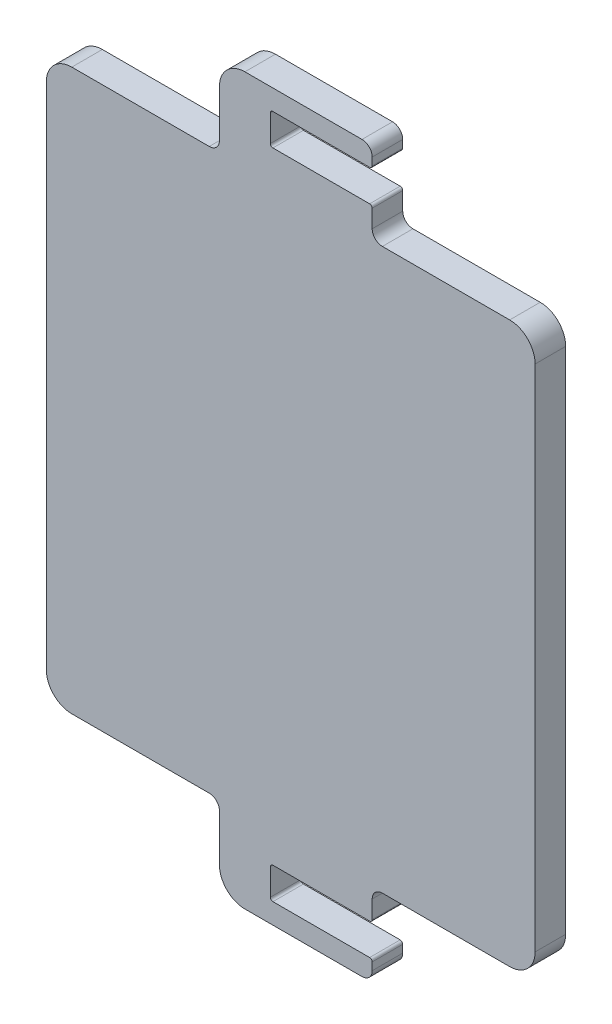
from build123d import *

# Parameters (mm, degrees)
SALIENTE_EXTRUIR1_DEPTH = 3
REDONDEO1_R             = 1
REDONDEO2_R             = 0.25


with BuildPart() as part:
    # Croquis1 → Saliente-Extruir1 (new body)
    with BuildSketch(Plane.XY):
        with BuildLine():
            Line((-24, 25), (-24, -25))
            ThreePointArc((-24, -25), (-23.267766953, -26.767766953), (-21.5, -27.5))
            Line((-21.5, -27.5), (-7, -27.5))
            Line((-7, -27.5), (-7, -33.1))
            ThreePointArc((-7, -33.1), (-6.267766953, -34.867766953), (-4.5, -35.6))
            Line((-4.5, -35.6), (8, -35.6))
            Line((8, -35.6), (8, -33.6))
            Line((8, -33.6), (-2, -33.6))
            Line((-2, -33.6), (-2, -30.5))
            Line((-2, -30.5), (8, -30.5))
            Line((8, -30.5), (8, -27.5))
            Line((8, -27.5), (21.5, -27.5))
            ThreePointArc((21.5, -27.5), (23.267766953, -26.767766953), (24, -25))
            Line((24, -25), (24, 25))
            ThreePointArc((24, 25), (23.267766953, 26.767766953), (21.5, 27.5))
            Line((21.5, 27.5), (8, 27.5))
            Line((8, 27.5), (8, 30.5))
            Line((8, 30.5), (-2, 30.5))
            Line((-2, 30.5), (-2, 33.6))
            Line((-2, 33.6), (8, 33.6))
            Line((8, 33.6), (8, 35.6))
            Line((8, 35.6), (-4.5, 35.6))
            ThreePointArc((-4.5, 35.6), (-6.267766953, 34.867766953), (-7, 33.1))
            Line((-7, 33.1), (-7, 27.5))
            Line((-7, 27.5), (-21.5, 27.5))
            ThreePointArc((-21.5, 27.5), (-23.267766953, 26.767766953), (-24, 25))
        make_face()
    extrude(amount=SALIENTE_EXTRUIR1_DEPTH)

    # Redondeo1
    redondeo1_edges = [part.edges().sort_by_distance(p)[0] for p in [
        (-7, 27.5, 1.5),
        (8, 35.6, 1.5),
        (8, 27.5, 1.5),
        (8, -27.5, 1.5),
        (8, -35.6, 1.5),
        (-7, -27.5, 1.5),
    ]]
    fillet(redondeo1_edges, radius=REDONDEO1_R)

    # Redondeo2
    redondeo2_edges = [part.edges().sort_by_distance(p)[0] for p in [
        (8, 33.6, 1.5),
        (-2, 33.6, 1.5),
        (-2, 30.5, 1.5),
        (8, 30.5, 1.5),
        (8, -30.5, 1.5),
        (-2, -30.5, 1.5),
        (-2, -33.6, 1.5),
        (8, -33.6, 1.5),
    ]]
    fillet(redondeo2_edges, radius=REDONDEO2_R)


solid = part.part
